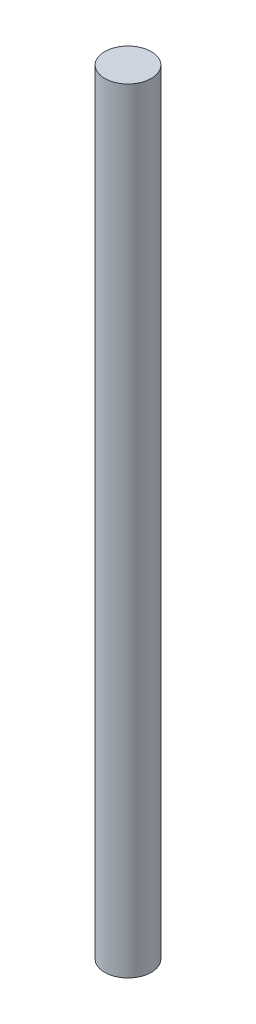
from build123d import *

# Parameters (mm, degrees)
SKETCH_1_R      = 35
EXTRUDE_1_DEPTH = 1164


with BuildPart() as part:
    # 草图1 → 凸台-拉伸1 (new body)
    with BuildSketch(Plane(origin=(0, 0, 0), x_dir=(1, 0, 0), z_dir=(0, 1, 0))):
        with Locations(Location((0, 0, 0), (0, 0, 270))):
            Circle(SKETCH_1_R)
    extrude(amount=EXTRUDE_1_DEPTH)


solid = part.part
